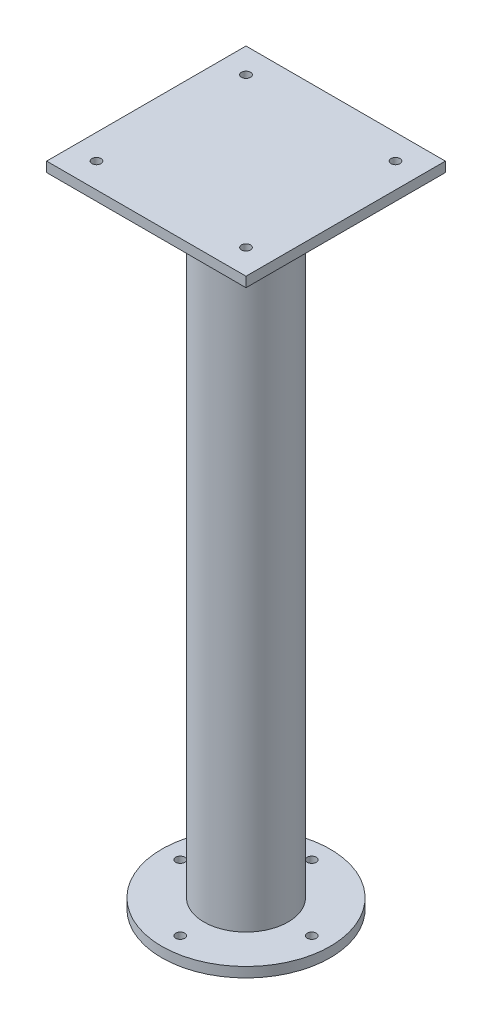
from build123d import *

# Parameters (mm, degrees)
SKETCH1_R           = 84.5
SKETCH1_R_2         = 4.5
BOSS_EXTRUDE4_DEPTH = 10
SKETCH2_R           = 42.25
BOSS_EXTRUDE5_DEPTH = 630
SKETCH4_W           = 200
SKETCH4_H           = 200
BOSS_EXTRUDE6_DEPTH = 10
CUT_EXTRUDE1_DEPTH  = 666.206734783


with BuildPart() as part:
    # Sketch1 → Boss-Extrude4 (new body)
    with BuildSketch(Plane(origin=(0, 0, 0), x_dir=(1, 0, 0), z_dir=(0, 1, 0))):
        with Locations(Location((0, 0, 0), (0, 0, 270))):
            Circle(SKETCH1_R)
        with Locations(Location((0, -66, 0), (0, 0, 270))):
            Circle(SKETCH1_R_2, mode=Mode.SUBTRACT)
        with Locations(Location((66, 0, 0), (0, 0, 270))):
            Circle(SKETCH1_R_2, mode=Mode.SUBTRACT)
        with Locations(Location((-66, 0, 0), (0, 0, 270))):
            Circle(SKETCH1_R_2, mode=Mode.SUBTRACT)
        with Locations(Location((0, 66, 0), (0, 0, 270))):
            Circle(SKETCH1_R_2, mode=Mode.SUBTRACT)
    extrude(amount=BOSS_EXTRUDE4_DEPTH)

    # Sketch2 → Boss-Extrude5 (add)
    with BuildSketch(Plane(origin=(0, 10, 0), x_dir=(1, 0, 0), z_dir=(0, 1, 0))):
        with Locations(Location((0, 0, 0), (0, 0, 270))):
            Circle(SKETCH2_R)
    extrude(amount=BOSS_EXTRUDE5_DEPTH)

    # Sketch4 → Boss-Extrude6 (add)
    with BuildSketch(Plane(origin=(0, 640, 0), x_dir=(1, 0, 0), z_dir=(0, 1, 0))):
        Rectangle(SKETCH4_W, SKETCH4_H)
    extrude(amount=BOSS_EXTRUDE6_DEPTH)

    # Sketch5 → Cut-Extrude1 (cut, through all)
    with BuildSketch(Plane(origin=(0, 650, 0), x_dir=(1, 0, 0), z_dir=(0, 1, 0))):
        with BuildLine():
            Line((-75, -70.5), (-75, -75))
            Line((-75, -75), (-70.5, -75))
            ThreePointArc((-70.5, -75), (-71.818019485, -71.818019485), (-75, -70.5))
        make_face()
        with BuildLine():
            Line((-70.5, -75), (-75, -75))
            Line((-75, -75), (-75, -70.5))
            ThreePointArc((-75, -70.5), (-78.181980515, -78.181980515), (-70.5, -75))
        make_face()
        with BuildLine():
            ThreePointArc((-70.5, 75), (-78.181980515, 78.181980515), (-75, 70.5))
            Line((-75, 70.5), (-75, 75))
            Line((-75, 75), (-70.5, 75))
        make_face()
        with BuildLine():
            Line((-75, 75), (-75, 70.5))
            ThreePointArc((-75, 70.5), (-71.818019485, 71.818019485), (-70.5, 75))
            Line((-70.5, 75), (-75, 75))
        make_face()
        with BuildLine():
            ThreePointArc((70.5, 75), (71.818019485, 71.818019485), (75, 70.5))
            Line((75, 70.5), (75, 75))
            Line((75, 75), (70.5, 75))
        make_face()
        with BuildLine():
            Line((75, 75), (75, 70.5))
            ThreePointArc((75, 70.5), (78.181980515, 71.818019485), (79.5, 75))
            ThreePointArc((79.5, 75), (75, 79.5), (70.5, 75))
            Line((70.5, 75), (75, 75))
        make_face()
        with BuildLine():
            ThreePointArc((75, -70.5), (71.818019485, -71.818019485), (70.5, -75))
            Line((70.5, -75), (75, -75))
            Line((75, -75), (75, -70.5))
        make_face()
        with BuildLine():
            Line((75, -75), (70.5, -75))
            ThreePointArc((70.5, -75), (75, -79.5), (79.5, -75))
            ThreePointArc((79.5, -75), (78.181980515, -71.818019485), (75, -70.5))
            Line((75, -70.5), (75, -75))
        make_face()
    extrude(amount=-CUT_EXTRUDE1_DEPTH, mode=Mode.SUBTRACT)


solid = part.part
